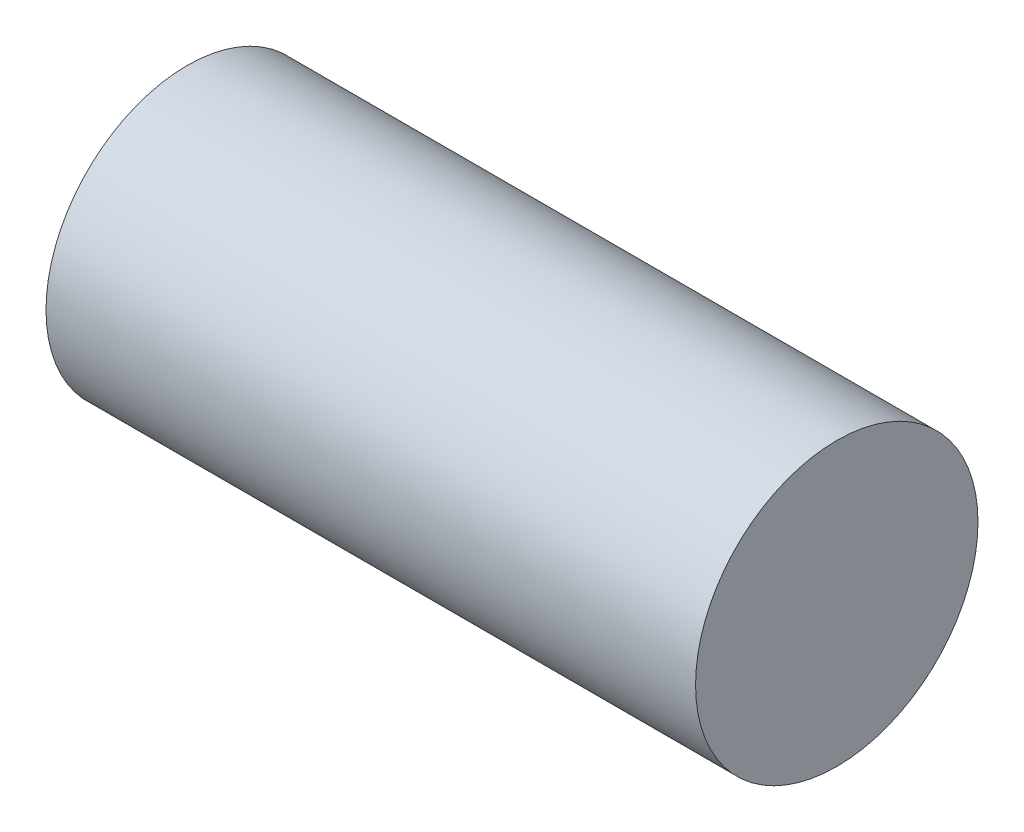
from build123d import *

# Parameters (mm, degrees)
SKETCH1_R           = 2
BOSS_EXTRUDE1_DEPTH = 9.2


with BuildPart() as part:
    # Sketch1 → Boss-Extrude1 (new body)
    with BuildSketch(Plane(origin=(0, 0, 0), x_dir=(0, 0, -1), z_dir=(1, 0, 0))):
        Circle(SKETCH1_R)
    extrude(amount=BOSS_EXTRUDE1_DEPTH)


solid = part.part
